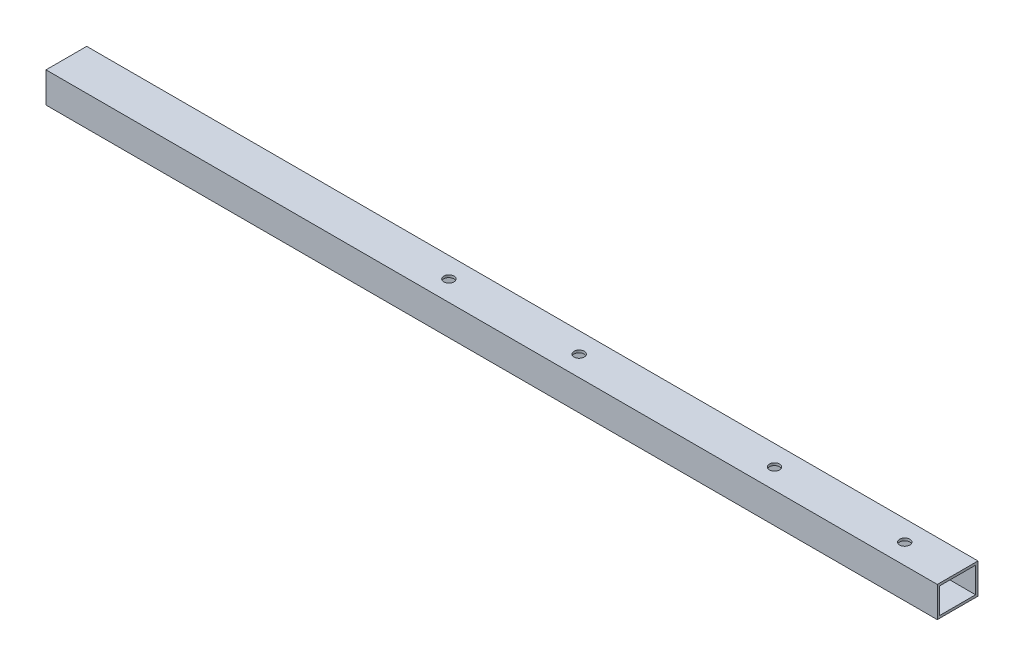
from build123d import *

# Parameters (mm, degrees)
SKETCH1_W               = 20
SKETCH1_H               = 15
SKETCH1_W_2             = 17.6
SKETCH1_H_2             = 12.6
F_15_X_20_X_1_2_1_DEPTH = 438
SKETCH_3_R              = 2.5
CUT_EXTRUDE_1_DEPTH     = 439.370847571


with BuildPart() as part:
    # Sketch1 → 方形管 15 X 20 X 1.2(1) (new body)
    with BuildSketch(Plane(origin=(0, 0, 0), x_dir=(0, 0, -1), z_dir=(1, 0, 0))):
        Rectangle(SKETCH1_W, SKETCH1_H)
        Rectangle(SKETCH1_W_2, SKETCH1_H_2, mode=Mode.SUBTRACT)
    extrude(amount=F_15_X_20_X_1_2_1_DEPTH)

    # 草图3 → 切除-拉伸1 (cut, through all)
    with BuildSketch(Plane(origin=(0, 7.5, 0), x_dir=(1, 0, 0), z_dir=(0, 1, 0))):
        with Locations(Location((188, 0, 0), (0, 0, 270))):
            Circle(SKETCH_3_R)
        with Locations(Location((252, 0, 0), (0, 0, 270))):
            Circle(SKETCH_3_R)
        with Locations(Location((348, 0, 0), (0, 0, 270))):
            Circle(SKETCH_3_R)
        with Locations(Location((412, 0, 0), (0, 0, 270))):
            Circle(SKETCH_3_R)
    extrude(amount=-CUT_EXTRUDE_1_DEPTH, mode=Mode.SUBTRACT)


solid = part.part
